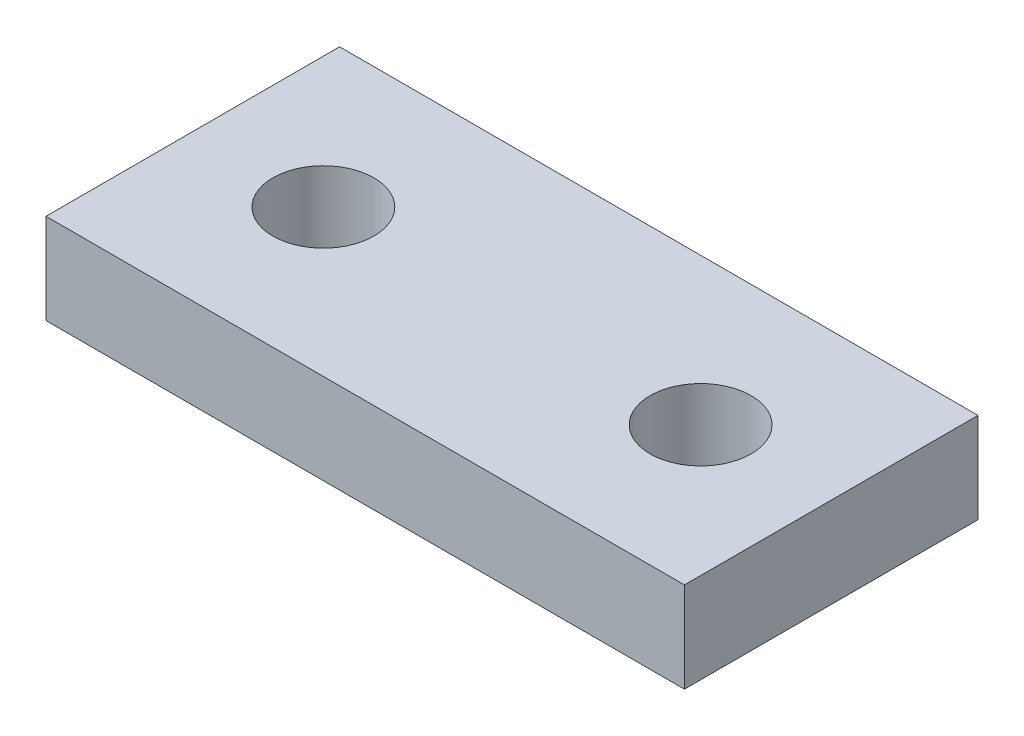
from build123d import *

# Parameters (mm, degrees)
SKETCH1_W           = 269.300822908
SKETCH1_H           = 123.833619398
BOSS_EXTRUDE1_DEPTH = 38.1
SKETCH2_R           = 21.308257488
CUT_EXTRUDE1_DEPTH  = 38.1


with BuildPart() as part:
    # Sketch1 → Boss-Extrude1 (new body)
    with BuildSketch(Plane(origin=(0, 0, 0), x_dir=(1, 0, 0), z_dir=(0, 1, 0))):
        Rectangle(SKETCH1_W, SKETCH1_H)
    extrude(amount=BOSS_EXTRUDE1_DEPTH)

    # Sketch2 → Cut-Extrude1 (cut)
    with BuildSketch(Plane(origin=(0, 38.1, 0), x_dir=(1, 0, 0), z_dir=(0, 1, 0))):
        with Locations(Location((-79.562250058, 0, 0), (0, 0, 270))):
            Circle(SKETCH2_R)
    cut_extrude1 = extrude(amount=-CUT_EXTRUDE1_DEPTH, mode=Mode.SUBTRACT)

    # Mirror1: Cut-Extrude1 across plane
    add(cut_extrude1.mirror(Plane(origin=(0, 0, 0), x_dir=(0, 0, 1), z_dir=(1, 0, 0))), mode=Mode.SUBTRACT)


solid = part.part
